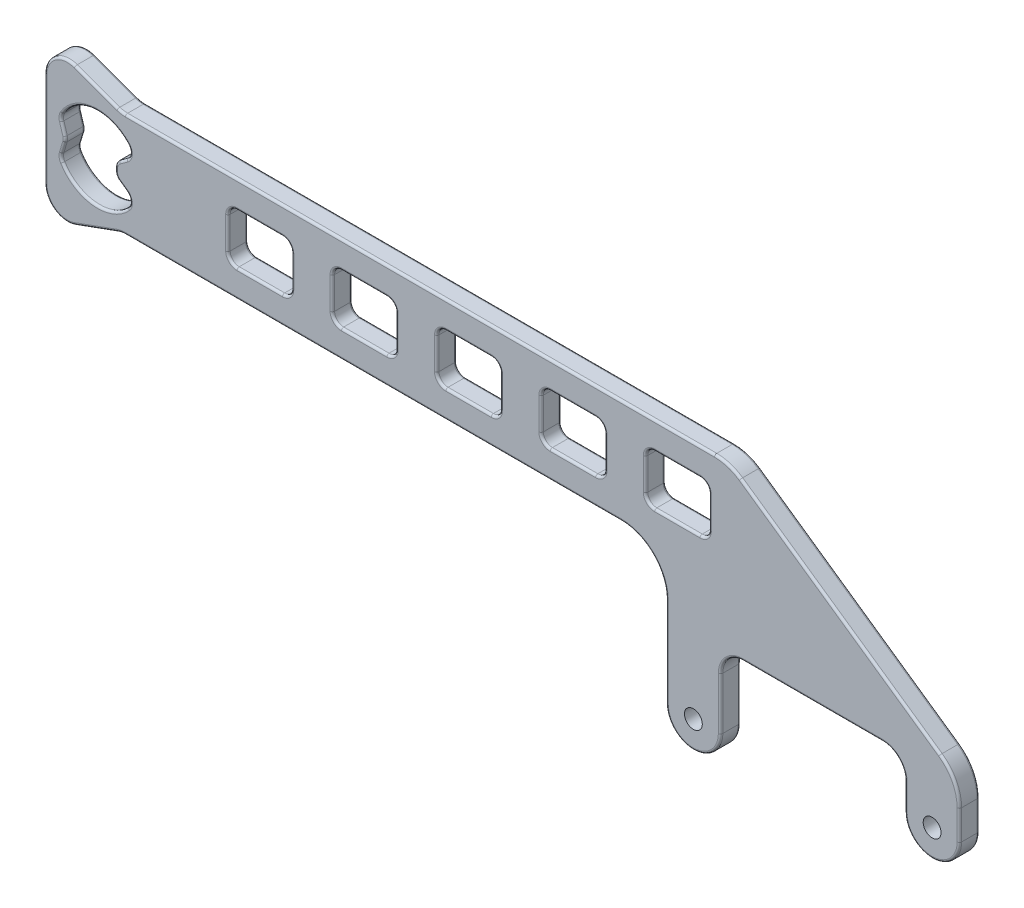
from build123d import *

# Parameters (mm, degrees)
SKETCH1_R           = 2.5
BOSS_EXTRUDE1_DEPTH = 5.588
CUT_EXTRUDE1_REACH  = 255.827
CUT_EXTRUDE3_REACH  = 255.827
CUT_EXTRUDE5_REACH  = 255.827
FILLET3_R           = 12.7
FILLET5_R           = 0.635


with BuildPart() as part:
    # Sketch1 → Boss-Extrude1 (new body)
    with BuildSketch(Plane.XY):
        with BuildLine():
            Line((-51.182091186, 70.222204159), (-51.182091186, 45.103986439))
            ThreePointArc((-51.182091186, 45.103986439), (-43.562091186, 37.483986439), (-35.942091186, 45.103986439))
            Line((-35.942091186, 45.103986439), (-35.942091186, 59.695316808))
            ThreePointArc((-35.942091186, 59.695316808), (-34.082219246, 64.185444868), (-29.592091186, 66.045316808))
            Line((-29.592091186, 66.045316808), (9.274999152, 66.045316808))
            ThreePointArc((9.274999152, 66.045316808), (13.765127212, 64.185444868), (15.624999152, 59.695316808))
            Line((15.624999152, 59.695316808), (15.624999152, 52.209122904))
            ThreePointArc((15.624999152, 52.209122904), (23.244999152, 44.589122904), (30.864999152, 52.209122904))
            Line((30.864999152, 52.209122904), (30.864999152, 105.782204159))
            ThreePointArc((30.864999152, 105.782204159), (29.005127212, 110.272332219), (24.514999152, 112.132204159))
            Line((24.514999152, 112.132204159), (-202.462414858, 112.132204159))
            ThreePointArc((-202.462414858, 112.132204159), (-203.565080787, 112.228674927), (-204.634242769, 112.515156017))
            Line((-204.634242769, 112.515156017), (-216.541636587, 116.849092934))
            ThreePointArc((-216.541636587, 116.849092934), (-222.355674868, 116.083660274), (-225.063464497, 110.882044792))
            Line((-225.063464497, 110.882044792), (-225.063464497, 84.172363525))
            ThreePointArc((-225.063464497, 84.172363525), (-222.355674868, 78.970748044), (-216.541636587, 78.205315383))
            Line((-216.541636587, 78.205315383), (-204.634242769, 82.539252301))
            ThreePointArc((-204.634242769, 82.539252301), (-203.565080787, 82.82573339), (-202.462414858, 82.922204159))
            Line((-202.462414858, 82.922204159), (-63.882091186, 82.922204159))
            ThreePointArc((-63.882091186, 82.922204159), (-54.901835065, 79.20246028), (-51.182091186, 70.222204159))
        make_face()
        with Locations((-43.562091186, 45.103986439)):
            Circle(SKETCH1_R, mode=Mode.SUBTRACT)
        with Locations((23.244999152, 52.209122904)):
            Circle(SKETCH1_R, mode=Mode.SUBTRACT)
    extrude(amount=BOSS_EXTRUDE1_DEPTH)

    # Sketch11 → Cut-Extrude1 (cut, up to next)
    with BuildSketch(Plane.XY.offset(5.588), mode=Mode.PRIVATE) as cut_extrude1_sk1:
        with BuildLine():
            Line((-202.217530242, 93.617340007), (-204.253450291, 95.067647925))
            ThreePointArc((-204.253450291, 95.067647925), (-205.050279195, 95.997874059), (-205.319117292, 97.192856502))
            Line((-205.319117292, 97.192856502), (-205.301795063, 97.972184987))
            ThreePointArc((-205.301795063, 97.972184987), (-205.008508687, 99.101784113), (-204.241046199, 99.980995359))
            Line((-204.241046199, 99.980995359), (-202.208582696, 101.436143329))
            ThreePointArc((-202.208582696, 101.436143329), (-201.161533022, 103.232003181), (-201.806235881, 105.208308787))
            ThreePointArc((-201.806235881, 105.208308787), (-211.375600888, 108.903665929), (-220.054942314, 103.435810459))
            ThreePointArc((-220.054942314, 103.435810459), (-220.4016633, 102.432732876), (-220.308241557, 101.375542043))
            Line((-220.308241557, 101.375542043), (-219.353686062, 98.274448953))
            ThreePointArc((-219.353686062, 98.274448953), (-219.241282655, 97.527204159), (-219.353686062, 96.779959365))
            Line((-219.353686062, 96.779959365), (-220.308241557, 93.678866275))
            ThreePointArc((-220.308241557, 93.678866275), (-220.4016633, 92.621675442), (-220.054942314, 91.618597859))
            ThreePointArc((-220.054942314, 91.618597859), (-211.379435938, 86.15111554), (-201.81141655, 89.840394439))
            ThreePointArc((-201.81141655, 89.840394439), (-201.165793024, 91.820121045), (-202.217530242, 93.617340007))
        make_face()
    cut_extrude1_tool1 = extrude(cut_extrude1_sk1.sketch, amount=-CUT_EXTRUDE1_REACH, mode=Mode.PRIVATE) & part.part
    add(cut_extrude1_tool1.solids().sort_by_distance((-211.037162, 97.52782, 5.588))[0], mode=Mode.SUBTRACT)

    # Sketch14 → Cut-Extrude3 (cut, up to next)
    with BuildSketch(Plane.XY.offset(5.588), mode=Mode.PRIVATE) as cut_extrude3_sk1:
        with BuildLine():
            ThreePointArc((-171.239588534, 104.512204159), (-173.035639759, 103.768255383), (-173.779588534, 101.972204159))
            Line((-173.779588534, 101.972204159), (-173.779588534, 93.082204159))
            ThreePointArc((-173.779588534, 93.082204159), (-173.035639759, 91.286152935), (-171.239588534, 90.542204159))
            Line((-171.239588534, 90.542204159), (-158.539588534, 90.542204159))
            ThreePointArc((-158.539588534, 90.542204159), (-156.74353731, 91.286152935), (-155.999588534, 93.082204159))
            Line((-155.999588534, 93.082204159), (-155.999588534, 101.972204159))
            ThreePointArc((-155.999588534, 101.972204159), (-156.74353731, 103.768255383), (-158.539588534, 104.512204159))
            Line((-158.539588534, 104.512204159), (-171.239588534, 104.512204159))
        make_face()
    cut_extrude3_tool1 = extrude(cut_extrude3_sk1.sketch, amount=-CUT_EXTRUDE3_REACH, mode=Mode.PRIVATE) & part.part
    # Sketch14 → Cut-Extrude3 (cut, up to next)
    with BuildSketch(Plane.XY.offset(5.588), mode=Mode.PRIVATE) as cut_extrude3_sk2:
        with BuildLine():
            ThreePointArc((-142.029588534, 104.512204159), (-143.825639759, 103.768255383), (-144.569588534, 101.972204159))
            Line((-144.569588534, 101.972204159), (-144.569588534, 93.082204159))
            ThreePointArc((-144.569588534, 93.082204159), (-143.825639759, 91.286152935), (-142.029588534, 90.542204159))
            Line((-142.029588534, 90.542204159), (-129.329588534, 90.542204159))
            ThreePointArc((-129.329588534, 90.542204159), (-127.53353731, 91.286152935), (-126.789588534, 93.082204159))
            Line((-126.789588534, 93.082204159), (-126.789588534, 101.972204159))
            ThreePointArc((-126.789588534, 101.972204159), (-127.53353731, 103.768255383), (-129.329588534, 104.512204159))
            Line((-129.329588534, 104.512204159), (-142.029588534, 104.512204159))
        make_face()
    cut_extrude3_tool2 = extrude(cut_extrude3_sk2.sketch, amount=-CUT_EXTRUDE3_REACH, mode=Mode.PRIVATE) & part.part
    # Sketch14 → Cut-Extrude3 (cut, up to next)
    with BuildSketch(Plane.XY.offset(5.588), mode=Mode.PRIVATE) as cut_extrude3_sk3:
        with BuildLine():
            ThreePointArc((-112.819588534, 104.512204159), (-114.615639759, 103.768255383), (-115.359588534, 101.972204159))
            Line((-115.359588534, 101.972204159), (-115.359588534, 93.082204159))
            ThreePointArc((-115.359588534, 93.082204159), (-114.615639759, 91.286152935), (-112.819588534, 90.542204159))
            Line((-112.819588534, 90.542204159), (-100.119588534, 90.542204159))
            ThreePointArc((-100.119588534, 90.542204159), (-98.32353731, 91.286152935), (-97.579588534, 93.082204159))
            Line((-97.579588534, 93.082204159), (-97.579588534, 101.972204159))
            ThreePointArc((-97.579588534, 101.972204159), (-98.32353731, 103.768255383), (-100.119588534, 104.512204159))
            Line((-100.119588534, 104.512204159), (-112.819588534, 104.512204159))
        make_face()
    cut_extrude3_tool3 = extrude(cut_extrude3_sk3.sketch, amount=-CUT_EXTRUDE3_REACH, mode=Mode.PRIVATE) & part.part
    # Sketch14 → Cut-Extrude3 (cut, up to next)
    with BuildSketch(Plane.XY.offset(5.588), mode=Mode.PRIVATE) as cut_extrude3_sk4:
        with BuildLine():
            ThreePointArc((-83.609588534, 104.512204159), (-85.405639759, 103.768255383), (-86.149588534, 101.972204159))
            Line((-86.149588534, 101.972204159), (-86.149588534, 93.082204159))
            ThreePointArc((-86.149588534, 93.082204159), (-85.405639759, 91.286152935), (-83.609588534, 90.542204159))
            Line((-83.609588534, 90.542204159), (-70.909588534, 90.542204159))
            ThreePointArc((-70.909588534, 90.542204159), (-69.11353731, 91.286152935), (-68.369588534, 93.082204159))
            Line((-68.369588534, 93.082204159), (-68.369588534, 101.972204159))
            ThreePointArc((-68.369588534, 101.972204159), (-69.11353731, 103.768255383), (-70.909588534, 104.512204159))
            Line((-70.909588534, 104.512204159), (-83.609588534, 104.512204159))
        make_face()
    cut_extrude3_tool4 = extrude(cut_extrude3_sk4.sketch, amount=-CUT_EXTRUDE3_REACH, mode=Mode.PRIVATE) & part.part
    # Sketch14 → Cut-Extrude3 (cut, up to next)
    with BuildSketch(Plane.XY.offset(5.588), mode=Mode.PRIVATE) as cut_extrude3_sk5:
        with BuildLine():
            ThreePointArc((-54.399588534, 104.512204159), (-56.195639759, 103.768255383), (-56.939588534, 101.972204159))
            Line((-56.939588534, 101.972204159), (-56.939588534, 93.082204159))
            ThreePointArc((-56.939588534, 93.082204159), (-56.195639759, 91.286152935), (-54.399588534, 90.542204159))
            Line((-54.399588534, 90.542204159), (-41.699588534, 90.542204159))
            ThreePointArc((-41.699588534, 90.542204159), (-39.90353731, 91.286152935), (-39.159588534, 93.082204159))
            Line((-39.159588534, 93.082204159), (-39.159588534, 101.972204159))
            ThreePointArc((-39.159588534, 101.972204159), (-39.90353731, 103.768255383), (-41.699588534, 104.512204159))
            Line((-41.699588534, 104.512204159), (-54.399588534, 104.512204159))
        make_face()
    cut_extrude3_tool5 = extrude(cut_extrude3_sk5.sketch, amount=-CUT_EXTRUDE3_REACH, mode=Mode.PRIVATE) & part.part
    add(cut_extrude3_tool1.solids().sort_by_distance((-164.889589, 97.527204, 5.588))[0], mode=Mode.SUBTRACT)
    add(cut_extrude3_tool2.solids().sort_by_distance((-135.679589, 97.527204, 5.588))[0], mode=Mode.SUBTRACT)
    add(cut_extrude3_tool3.solids().sort_by_distance((-106.469589, 97.527204, 5.588))[0], mode=Mode.SUBTRACT)
    add(cut_extrude3_tool4.solids().sort_by_distance((-77.259589, 97.527204, 5.588))[0], mode=Mode.SUBTRACT)
    add(cut_extrude3_tool5.solids().sort_by_distance((-48.049589, 97.527204, 5.588))[0], mode=Mode.SUBTRACT)

    # Sketch17 → Cut-Extrude5 (cut, up to next)
    with BuildSketch(Plane.XY.offset(5.588), mode=Mode.PRIVATE) as cut_extrude5_sk1:
        with BuildLine():
            Line((-33.645691556, 112.132204159), (30.864999152, 67.131076148))
            Line((30.864999152, 67.131076148), (30.864999152, 105.782204159))
            ThreePointArc((30.864999152, 105.782204159), (29.005127212, 110.272332219), (24.514999152, 112.132204159))
            Line((24.514999152, 112.132204159), (-33.645691556, 112.132204159))
        make_face()
    cut_extrude5_tool1 = extrude(cut_extrude5_sk1.sketch, amount=-CUT_EXTRUDE5_REACH, mode=Mode.PRIVATE) & part.part
    add(cut_extrude5_tool1.solids().sort_by_distance((9.24098, 97.050373, 5.588))[0], mode=Mode.SUBTRACT)

    # Fillet3
    fillet3_edges = [part.edges().sort_by_distance(p)[0] for p in [
        (-33.645691556, 112.132204159, 2.794),
        (30.864999152, 67.131076148, 2.794),
    ]]
    fillet(fillet3_edges, radius=FILLET3_R)

    # Fillet5
    fillet5_edges = [part.edges().sort_by_distance(p)[0] for p in [
        (-203.565080787, 112.228674927, 0),
        (-222.355674868, 116.083660274, 0),
        (-222.355674868, 78.970748044, 0),
        (-210.587939678, 80.372283842, 0),
        (-203.565080787, 82.82573339, 0),
        (-133.172253022, 82.922204159, 0),
        (-54.901835065, 79.20246028, 0),
        (-35.942091186, 52.399651623, 0),
        (-34.082219246, 64.185444868, 0),
        (-10.158546017, 66.045316808, 0),
        (13.765127212, 64.185444868, 0),
        (15.624999152, 55.952219856, 0),
        (23.244999152, 44.589122904, 0),
        (30.864999152, 56.357361779, 0),
        (29.424849017, 66.379762807, 0),
        (-2.470305809, 90.384994364, 0),
        (-33.829391946, 111.547780246, 0),
        (-120.050031553, 112.132204159, 0),
        (-211.375600888, 108.903665929, 0),
        (-201.161533022, 103.232003181, 0),
        (-203.224814447, 100.708569344, 0),
        (-205.008508687, 99.101784113, 0),
        (-205.050279195, 95.997874059, 0),
        (-203.235490266, 94.342493966, 0),
        (-201.165793024, 91.820121045, 0),
        (-220.4016633, 92.621675442, 0),
        (-219.830963809, 95.22941282, 0),
        (-219.241282655, 97.527204159, 0),
        (-219.830963809, 99.824995498, 0),
        (-126.789588534, 97.527204159, 0),
        (-127.53353731, 91.286152935, 0),
        (-135.679588534, 90.542204159, 0),
        (-143.825639759, 91.286152935, 0),
        (-143.825639759, 103.768255383, 0),
        (-135.679588534, 104.512204159, 0),
        (-127.53353731, 103.768255383, 0),
        (-156.74353731, 91.286152935, 0),
        (-164.889588534, 90.542204159, 0),
        (-173.779588534, 97.527204159, 0),
        (-173.035639759, 103.768255383, 0),
        (-164.889588534, 104.512204159, 0),
        (-155.999588534, 97.527204159, 0),
        (-98.32353731, 103.768255383, 0),
        (-98.32353731, 91.286152935, 0),
        (-106.469588534, 90.542204159, 0),
        (-114.615639759, 91.286152935, 0),
        (-115.359588534, 97.527204159, 0),
        (-69.11353731, 103.768255383, 0),
        (-68.369588534, 97.527204159, 0),
        (-85.405639759, 91.286152935, 0),
        (-86.149588534, 97.527204159, 0),
        (-85.405639759, 103.768255383, 0),
        (-77.259588534, 104.512204159, 0),
        (-39.90353731, 103.768255383, 0),
        (-39.159588534, 97.527204159, 0),
        (-48.049588534, 90.542204159, 0),
        (-56.195639759, 91.286152935, 0),
        (-56.939588534, 97.527204159, 0),
        (-56.195639759, 103.768255383, 0),
        (-220.4016633, 92.621675442, 5.588),
        (-211.379435938, 86.15111554, 5.588),
        (-201.165793024, 91.820121045, 5.588),
        (-205.050279195, 95.997874059, 5.588),
        (-205.310456178, 97.582520745, 5.588),
        (-205.008508687, 99.101784113, 5.588),
        (-203.224814447, 100.708569344, 5.588),
        (-201.161533022, 103.232003181, 5.588),
        (-219.830963809, 99.824995498, 5.588),
        (-219.241282655, 97.527204159, 5.588),
        (-143.825639759, 103.768255383, 5.588),
        (-144.569588534, 97.527204159, 5.588),
        (-135.679588534, 90.542204159, 5.588),
        (-127.53353731, 91.286152935, 5.588),
        (-126.789588534, 97.527204159, 5.588),
        (-127.53353731, 103.768255383, 5.588),
        (-135.679588534, 104.512204159, 5.588),
        (-164.889588534, 104.512204159, 5.588),
        (-173.035639759, 103.768255383, 5.588),
        (-173.779588534, 97.527204159, 5.588),
        (-173.035639759, 91.286152935, 5.588),
        (-164.889588534, 90.542204159, 5.588),
        (-156.74353731, 91.286152935, 5.588),
        (-155.999588534, 97.527204159, 5.588),
        (-106.469588534, 90.542204159, 5.588),
        (-97.579588534, 97.527204159, 5.588),
        (-98.32353731, 103.768255383, 5.588),
        (-114.615639759, 103.768255383, 5.588),
        (-85.405639759, 91.286152935, 5.588),
        (-77.259588534, 90.542204159, 5.588),
        (-69.11353731, 91.286152935, 5.588),
        (-68.369588534, 97.527204159, 5.588),
        (-77.259588534, 104.512204159, 5.588),
        (-85.405639759, 103.768255383, 5.588),
        (-56.939588534, 97.527204159, 5.588),
        (-56.195639759, 91.286152935, 5.588),
        (-39.90353731, 91.286152935, 5.588),
        (-39.159588534, 97.527204159, 5.588),
        (-39.90353731, 103.768255383, 5.588),
        (-48.049588534, 104.512204159, 5.588),
        (-56.195639759, 103.768255383, 5.588),
        (29.424849017, 66.379762807, 5.588),
        (30.864999152, 56.357361779, 5.588),
        (-10.158546017, 66.045316808, 5.588),
        (-35.942091186, 52.399651623, 5.588),
        (-54.901835065, 79.20246028, 5.588),
        (-133.172253022, 82.922204159, 5.588),
        (-210.587939678, 80.372283842, 5.588),
        (-222.355674868, 78.970748044, 5.588),
        (-225.063464497, 97.527204159, 5.588),
        (-222.355674868, 116.083660274, 5.588),
        (-210.587939678, 114.682124476, 5.588),
        (-203.565080787, 112.228674927, 5.588),
        (-120.050031553, 112.132204159, 5.588),
        (-33.829391946, 111.547780246, 5.588),
        (-2.470305809, 90.384994364, 5.588),
    ]]
    fillet(fillet5_edges, radius=FILLET5_R)


solid = part.part
